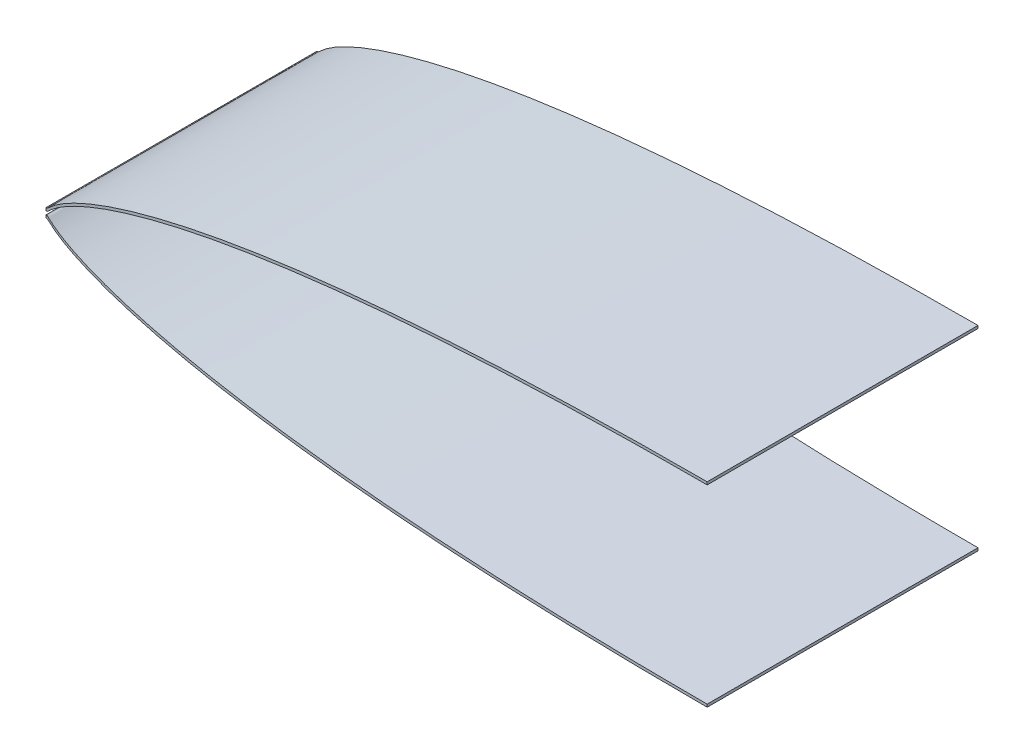
from build123d import *

# Parameters (mm, degrees)
BOSS_EXTRUDE1_DEPTH = 250


with BuildPart() as part:
    # Sketch2 → Boss-Extrude1 (new, symmetric)
    with BuildSketch(Plane.XY):
        with BuildLine():
            Line((0, 3.290724162), (-1, 3.290724162))
            Line((-1, 3.290724162), (-1, 8.290724162))
            Line((-1, 8.290724162), (0, 8.290724162))
            add(Edge.make_bspline(
                [(0, 8.290724162), (0.012511107, 8.290765357), (0.03753332, 8.290847745), (0.075061758, 8.291514111), (0.162605328, 8.293995892), (0.312504205, 8.30342889), (0.560904919, 8.33474646), (0.842649095, 8.395099697), (1.14102214, 8.490003992), (1.417967257, 8.606834688), (1.683114535, 8.748413961), (1.902865215, 8.892920821), (2.041739387, 8.999777737), (2.109280925, 9.055529349), (2.137954387, 9.079749871), (2.166344173, 9.104301902), (2.194472845, 9.12915357), (3.420703588, 10.244498572), (5.081675935, 11.760619068), (7.148837065, 13.59246377), (8.381488176, 14.658220466), (9.542782416, 15.639412456), (10.695256993, 16.590669721), (11.867468282, 17.535905054), (13.076890026, 18.488544181), (14.336179841, 19.457368581), (15.655674057, 20.448739356), (17.044549544, 21.467648116), (18.511451698, 22.518262333), (20.064867519, 23.604237317), (21.713370021, 24.728905385), (23.465792552, 25.895397048), (25.331364057, 27.10672193), (27.319822358, 28.365824796), (29.441515634, 29.675625522), (31.707498482, 31.039048311), (34.129626845, 32.459043451), (36.720654847, 33.9386037), (39.49433591, 35.480776638), (42.465530071, 37.088673856), (45.650319254, 38.76547753), (49.066132107, 40.5144447), (52.731880046, 42.338909432), (56.668106173, 44.242282893), (60.897148854, 46.228051291), (65.443321878, 48.299771543), (70.333113331, 50.461064421), (75.595405506, 52.715604903), (81.261718492, 55.067109311), (87.366480347, 57.519318776), (93.94732718, 60.075978444), (101.045436844, 62.740811734), (108.705900463, 65.517488837), (116.978136557, 68.409588473), (125.91635317, 71.420551798), (135.580064179, 74.553627098), (146.034666769, 77.811803716), (157.35208808, 81.19773337), (169.611510153, 84.713636693), (182.900183618, 88.361192455), (197.31434207, 92.141406484), (212.960230866, 96.054456772), (229.955266095, 100.099510618), (248.429341838, 104.274508964), (268.526306627, 108.575912143), (290.405633189, 112.998400286), (314.244309353, 117.534520357), (340.238982376, 122.174270332), (368.608394089, 126.90460929), (399.596150339, 131.708880087), (433.473875284, 136.566128752), (470.544809508, 141.450301878), (511.1479208, 146.329299151), (555.662608162, 151.16385593), (604.514093499, 155.90621675), (658.179611916, 160.498591911), (717.195531189, 164.871220394), (782.165554509, 168.940546825), (853.770188039, 172.605019338), (932.777690956, 175.748909882), (1020.056755021, 178.208698768), (1116.591256834, 179.898612089), (1184.143161464, 180.114585739), (1219.637056249, 180.228065086)],
                knots=[0, 0, 0, 0, 3.0156e-05, 6.0312e-05, 9.0467e-05, 0.000241246, 0.000422181, 0.000693584, 0.00093483, 0.001176077, 0.001417323, 0.001658569, 0.001809349, 0.001839504, 0.00186966, 0.001899816, 0.001929972, 0.001960128, 0.005895145, 0.007350407, 0.008617397, 0.009822694, 0.011014787, 0.012219209, 0.013452192, 0.014725546, 0.016048778, 0.017430169, 0.01887736, 0.020397716, 0.021998558, 0.023687335, 0.025471743, 0.027359837, 0.029360114, 0.031481601, 0.033733932, 0.03612743, 0.038673189, 0.041383159, 0.044270241, 0.047348387, 0.050632704, 0.054139575, 0.057886788, 0.061893677, 0.06618128, 0.070772511, 0.075692352, 0.080968068, 0.08662944, 0.092709033, 0.099242486, 0.106268838, 0.113830896, 0.121975643, 0.130754697, 0.140224817, 0.150448488, 0.161494558, 0.173438975, 0.186365598, 0.200367125, 0.215546137, 0.232016278, 0.249903593, 0.269348042, 0.290505225, 0.313548338, 0.338670406, 0.366086826, 0.396038279, 0.428794053, 0.464655863, 0.50396223, 0.547093517, 0.594477738, 0.646597261, 0.703996556, 0.767291176, 0.837178189, 0.914448301, 1, 1, 1, 1], degree=3))
            Line((1219.637056249, 180.228065086), (1219.637056249, 175.228065086))
            add(Edge.make_bspline(
                [(0, 3.290724162), (0.012511107, 3.290765357), (0.03753332, 3.290847745), (0.075061758, 3.291514111), (0.162605328, 3.293995892), (0.312504205, 3.30342889), (0.560904919, 3.33474646), (0.842649095, 3.395099697), (1.14102214, 3.490003992), (1.417967257, 3.606834688), (1.683114535, 3.748413961), (1.902865215, 3.892920821), (2.041739387, 3.999777737), (2.109280925, 4.055529349), (2.137954387, 4.079749871), (2.166344173, 4.104301902), (2.194472845, 4.12915357), (3.420703588, 5.244498572), (5.081675935, 6.760619068), (7.148837065, 8.59246377), (8.381488176, 9.658220466), (9.542782416, 10.639412456), (10.695256993, 11.590669721), (11.867468282, 12.535905054), (13.076890026, 13.488544181), (14.336179841, 14.457368581), (15.655674057, 15.448739356), (17.044549544, 16.467648116), (18.511451698, 17.518262333), (20.064867519, 18.604237317), (21.713370021, 19.728905385), (23.465792552, 20.895397048), (25.331364057, 22.10672193), (27.319822358, 23.365824796), (29.441515634, 24.675625522), (31.707498482, 26.039048311), (34.129626845, 27.459043451), (36.720654847, 28.9386037), (39.49433591, 30.480776638), (42.465530071, 32.088673856), (45.650319254, 33.76547753), (49.066132107, 35.5144447), (52.731880046, 37.338909432), (56.668106173, 39.242282893), (60.897148854, 41.228051291), (65.443321878, 43.299771543), (70.333113331, 45.461064421), (75.595405506, 47.715604903), (81.261718492, 50.067109311), (87.366480347, 52.519318776), (93.94732718, 55.075978444), (101.045436844, 57.740811734), (108.705900463, 60.517488837), (116.978136557, 63.409588473), (125.91635317, 66.420551798), (135.580064179, 69.553627098), (146.034666769, 72.811803716), (157.35208808, 76.19773337), (169.611510153, 79.713636693), (182.900183618, 83.361192455), (197.31434207, 87.141406484), (212.960230866, 91.054456772), (229.955266095, 95.099510618), (248.429341838, 99.274508964), (268.526306627, 103.575912143), (290.405633189, 107.998400286), (314.244309353, 112.534520357), (340.238982376, 117.174270332), (368.608394089, 121.90460929), (399.596150339, 126.708880087), (433.473875284, 131.566128752), (470.544809508, 136.450301878), (511.1479208, 141.329299151), (555.662608162, 146.16385593), (604.514093499, 150.90621675), (658.179611916, 155.498591911), (717.195531189, 159.871220394), (782.165554509, 163.940546825), (853.770188039, 167.605019338), (932.777690956, 170.748909882), (1020.056755021, 173.208698768), (1116.591256834, 174.898612089), (1184.143161464, 175.114585739), (1219.637056249, 175.228065086)],
                knots=[0, 0, 0, 0, 3.0156e-05, 6.0312e-05, 9.0467e-05, 0.000241246, 0.000422181, 0.000693584, 0.00093483, 0.001176077, 0.001417323, 0.001658569, 0.001809349, 0.001839504, 0.00186966, 0.001899816, 0.001929972, 0.001960128, 0.005895145, 0.007350407, 0.008617397, 0.009822694, 0.011014787, 0.012219209, 0.013452192, 0.014725546, 0.016048778, 0.017430169, 0.01887736, 0.020397716, 0.021998558, 0.023687335, 0.025471743, 0.027359837, 0.029360114, 0.031481601, 0.033733932, 0.03612743, 0.038673189, 0.041383159, 0.044270241, 0.047348387, 0.050632704, 0.054139575, 0.057886788, 0.061893677, 0.06618128, 0.070772511, 0.075692352, 0.080968068, 0.08662944, 0.092709033, 0.099242486, 0.106268838, 0.113830896, 0.121975643, 0.130754697, 0.140224817, 0.150448488, 0.161494558, 0.173438975, 0.186365598, 0.200367125, 0.215546137, 0.232016278, 0.249903593, 0.269348042, 0.290505225, 0.313548338, 0.338670406, 0.366086826, 0.396038279, 0.428794053, 0.464655863, 0.50396223, 0.547093517, 0.594477738, 0.646597261, 0.703996556, 0.767291176, 0.837178189, 0.914448301, 1, 1, 1, 1], degree=3))
        make_face()
    extrude(amount=BOSS_EXTRUDE1_DEPTH, both=True)


with BuildPart() as body_2:
    # Mirror2: mirrored copy
    add(part.part.mirror(Plane.ZX))


solid = Compound([part.part, body_2.part])
